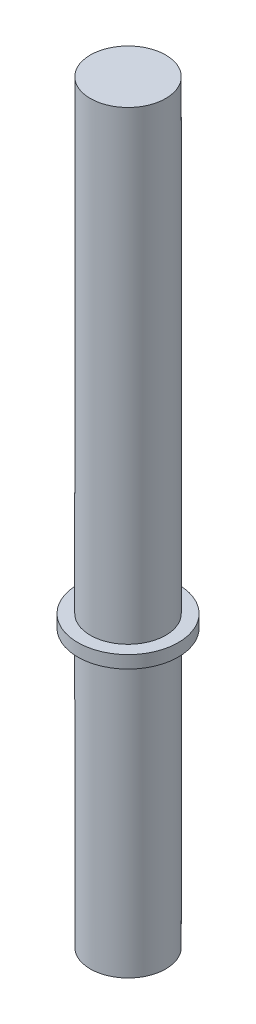
from build123d import *

# Parameters (mm, degrees)
SKETCH_1_R      = 1.5
EXTRUDE_1_DEPTH = 30
EXTRUDE_START   = -11
SKETCH_2_R      = 2
SKETCH_2_R_2    = 1.5
EXTRUDE_2_DEPTH = 0.5


with BuildPart() as part:
    # 草图1 → 凸台-拉伸1 (new body)
    with BuildSketch(Plane(origin=(0, 0, 0), x_dir=(1, 0, 0), z_dir=(0, 1, 0))):
        with Locations(Location((0, 0, 0), (0, 0, 270))):
            Circle(SKETCH_1_R)
    extrude(amount=EXTRUDE_1_DEPTH)

    # 草图2 → 凸台-拉伸2 (add)
    with BuildSketch(Plane.XZ.offset(EXTRUDE_START)):
        with Locations(Location((0, 0, 0), (0, 0, 270))):
            Circle(SKETCH_2_R)
        with Locations(Location((0, 0, 0), (0, 0, 270))):
            Circle(SKETCH_2_R_2, mode=Mode.SUBTRACT)
    extrude(amount=-EXTRUDE_2_DEPTH)


solid = part.part
